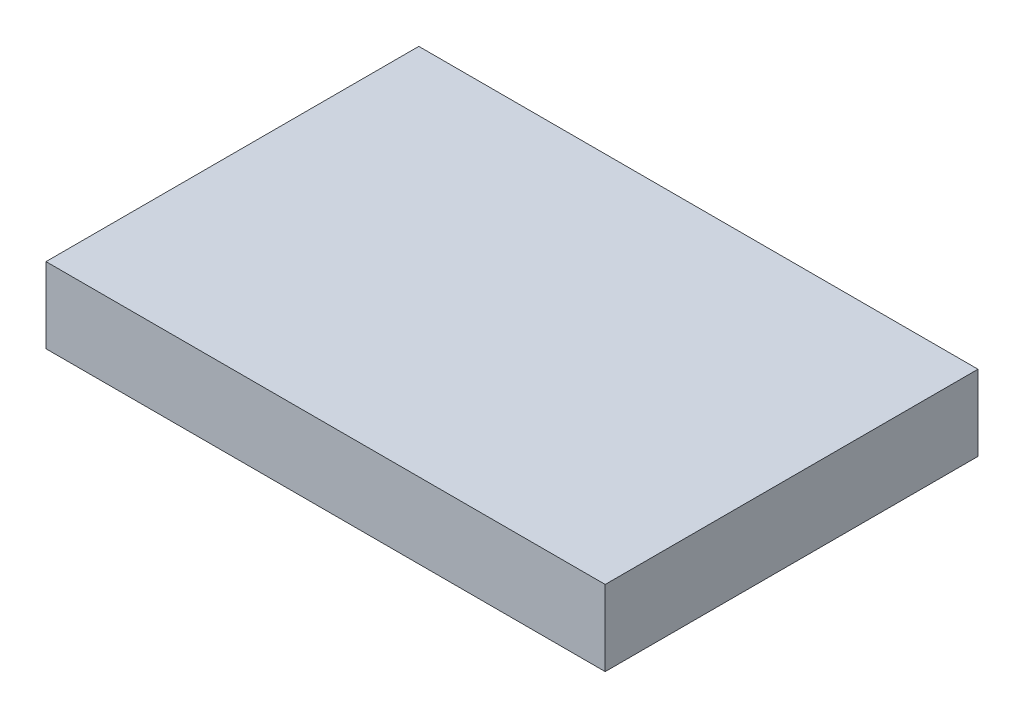
from build123d import *

# Parameters (mm, degrees)
SKETCH1_W           = 23.7
SKETCH1_H           = 15.8
BOSS_EXTRUDE1_DEPTH = 3.2


with BuildPart() as part:
    # Sketch1 → Boss-Extrude1 (new body)
    with BuildSketch(Plane(origin=(0, 0, 0), x_dir=(1, 0, 0), z_dir=(0, 1, 0))):
        with Locations((11.85, 7.9)):
            Rectangle(SKETCH1_W, SKETCH1_H)
    extrude(amount=BOSS_EXTRUDE1_DEPTH)


solid = part.part
